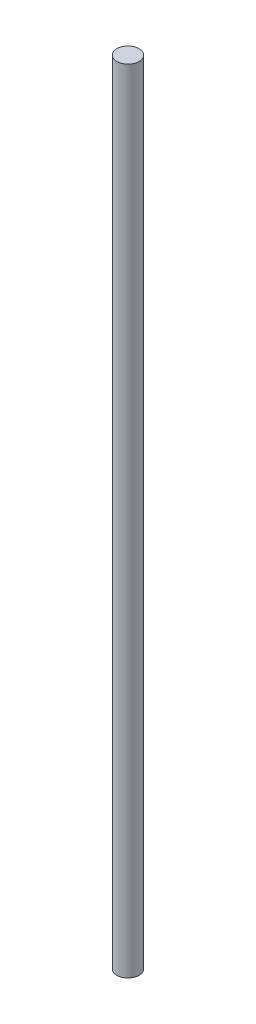
from build123d import *

# Parameters (mm, degrees)
SKETCH1_R        = 5
EXTRUSION1_DEPTH = 355.6


with BuildPart() as part:
    # Sketch1 → Extrusion1 (new body)
    with BuildSketch(Plane(origin=(0, 0, 0), x_dir=(-1, 0, 0), z_dir=(0, 1, 0))):
        with Locations(Location((0, 0, 0), (0, 0, 90))):
            Circle(SKETCH1_R)
    extrude(amount=EXTRUSION1_DEPTH)


solid = part.part
